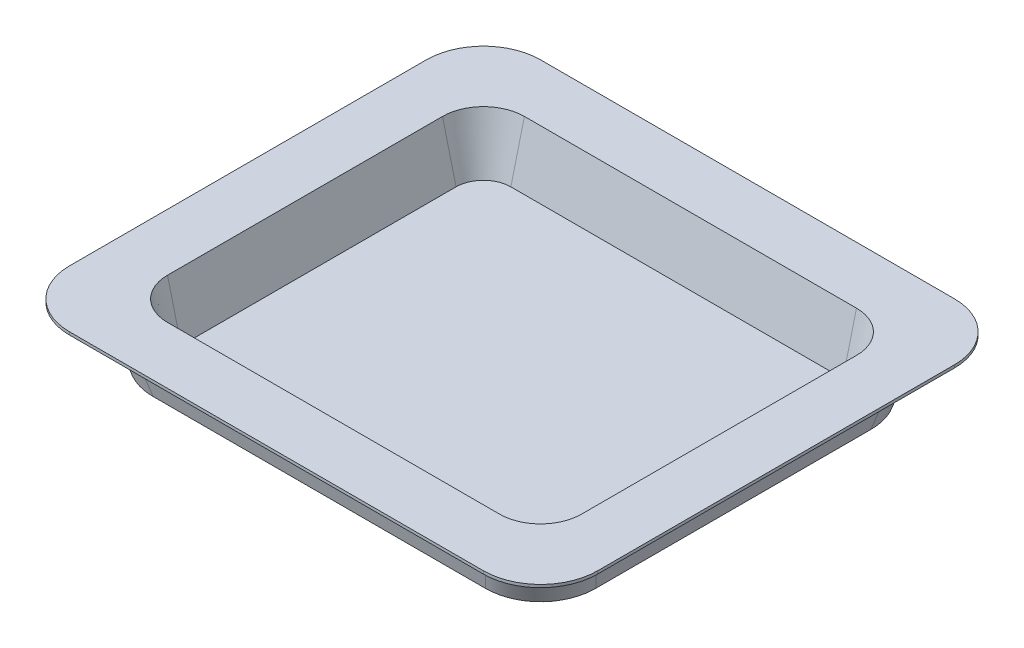
from build123d import *

# Parameters (mm, degrees)
SKETCH8_W                = 469.9
SKETCH8_H                = 419.1
BOSS_EXTRUDE1_DEPTH      = 50.8
CUT_EXTRUDE3_DEPTH       = 48.26
CUT_EXTRUDE4_DEPTH       = 48.26
CUT_EXTRUDE5_DEPTH       = 48.26
CUT_EXTRUDE6_DEPTH       = 48.26
CUT_EXTRUDE7_DEPTH       = 416.052
CUT_EXTRUDE8_DEPTH       = 69.342
CUT_EXTRUDE9_DEPTH       = 104.902
CUT_EXTRUDE9_DEPTH_BACK  = 516.128
CUT_EXTRUDE10_DEPTH      = 483.87
CUT_EXTRUDE10_DEPTH_BACK = 154.432
CUT_EXTRUDE11_DEPTH      = 419.608
CUT_EXTRUDE11_DEPTH_BACK = 113.03
FILLET1_R                = 50.8
FILLET2_R                = 50.8
FILLET3_R                = 50.8
FILLET4_R                = 50.8
CUT_EXTRUDE12_DEPTH      = 113.03
CUT_EXTRUDE13_DEPTH      = 113.03
CUT_EXTRUDE14_DEPTH      = 113.03
CUT_EXTRUDE15_DEPTH      = 113.03
CUT_EXTRUDE18_DEPTH      = 48.26
CUT_EXTRUDE18_TAPER      = 14
BODY_MOVE_COPY1_ANGLE    = 180


with BuildPart() as part:
    # Sketch8 → Boss-Extrude1 (new body)
    with BuildSketch(Plane(origin=(0, 0, 0), x_dir=(1, 0, 0), z_dir=(0, 1, 0))):
        with Locations((163.124113973, 170.845238095)):
            Rectangle(SKETCH8_W, SKETCH8_H)
    extrude(amount=-BOSS_EXTRUDE1_DEPTH)

    # Sketch9 → Cut-Extrude3 (cut)
    with BuildSketch(Plane(origin=(0, 0, 0), x_dir=(1, 0, 0), z_dir=(0, 1, 0))):
        Polygon((-46.425886027, -13.304761905), (372.674113973, -13.304761905), (398.074113973, -38.704761905), (-71.825886027, -38.704761905), align=None)
    extrude(amount=-CUT_EXTRUDE3_DEPTH, mode=Mode.SUBTRACT)

    # Sketch11 → Cut-Extrude4 (cut)
    with BuildSketch(Plane(origin=(0, 0, 0), x_dir=(1, 0, 0), z_dir=(0, 1, 0))):
        Polygon((-46.425886027, 354.995238095), (-46.425886027, -13.304761905), (-71.825886027, -38.704761905), (-71.825886027, 380.395238095), align=None)
    extrude(amount=-CUT_EXTRUDE4_DEPTH, mode=Mode.SUBTRACT)

    # Sketch13 → Cut-Extrude5 (cut)
    with BuildSketch(Plane(origin=(0, 0, 0), x_dir=(1, 0, 0), z_dir=(0, 1, 0))):
        Polygon((-46.425886027, 354.995238095), (372.674113973, 354.995238095), (398.074113973, 380.395238095), (-71.825886027, 380.395238095), align=None)
    extrude(amount=-CUT_EXTRUDE5_DEPTH, mode=Mode.SUBTRACT)

    # Sketch14 → Cut-Extrude6 (cut)
    with BuildSketch(Plane(origin=(0, 0, 0), x_dir=(1, 0, 0), z_dir=(0, 1, 0))):
        Polygon((398.074113973, 380.395238095), (372.674113973, 354.995238095), (372.674113973, -13.304761905), (398.074113973, -38.704761905), align=None)
    extrude(amount=-CUT_EXTRUDE6_DEPTH, mode=Mode.SUBTRACT)

    # Sketch16 → Cut-Extrude7 (cut)
    with BuildSketch(Plane.XY):
        Polygon((-46.425886027, 0), (-33.725886027, 0), (-46.425886027, -48.26), align=None)
    extrude(amount=-CUT_EXTRUDE7_DEPTH, mode=Mode.SUBTRACT)

    # Sketch17 → Cut-Extrude8 (cut)
    with BuildSketch(Plane.XY):
        Polygon((-33.725886027, 0), (-46.425886027, 0), (-46.425886027, -48.26), align=None)
    extrude(amount=CUT_EXTRUDE8_DEPTH, mode=Mode.SUBTRACT)

    # Sketch18 → Cut-Extrude9 (cut, two sides: drawn at the far end of the back side and taken through both)
    with BuildSketch(Plane.XY.offset(-CUT_EXTRUDE9_DEPTH_BACK)):
        Polygon((372.674113973, 0), (359.974113973, 0), (372.674113973, -48.26), align=None)
    extrude(amount=CUT_EXTRUDE9_DEPTH + CUT_EXTRUDE9_DEPTH_BACK, mode=Mode.SUBTRACT)

    # Sketch19 → Cut-Extrude10 (cut, two sides: drawn at the far end of the back side and taken through both)
    with BuildSketch(Plane(origin=(0, 0, 0), x_dir=(0, 0, -1), z_dir=(1, 0, 0)).offset(-CUT_EXTRUDE10_DEPTH_BACK)):
        Polygon((-13.304761905, 0), (-0.604761905, 0), (-13.304761905, -48.26), align=None)
    extrude(amount=CUT_EXTRUDE10_DEPTH + CUT_EXTRUDE10_DEPTH_BACK, mode=Mode.SUBTRACT)

    # Sketch20 → Cut-Extrude11 (cut, two sides: drawn at the far end of the back side and taken through both)
    with BuildSketch(Plane(origin=(0, 0, 0), x_dir=(0, 0, -1), z_dir=(1, 0, 0)).offset(-CUT_EXTRUDE11_DEPTH_BACK)):
        Polygon((354.995238095, 0), (342.295238095, 0), (354.995238095, -48.26), align=None)
    extrude(amount=CUT_EXTRUDE11_DEPTH + CUT_EXTRUDE11_DEPTH_BACK, mode=Mode.SUBTRACT)

    # Fillet1
    fillet1_edges = [part.edges().sort_by_distance(p)[0] for p in [
        (-40.075886027, -24.13, 6.954761905),
    ]]
    fillet(fillet1_edges, radius=FILLET1_R)

    # Fillet2
    fillet2_edges = [part.edges().sort_by_distance(p)[0] for p in [
        (-40.075886027, -24.13, -348.645238095),
    ]]
    fillet(fillet2_edges, radius=FILLET2_R)

    # Fillet3
    fillet3_edges = [part.edges().sort_by_distance(p)[0] for p in [
        (366.324113973, -24.13, -348.645238095),
    ]]
    fillet(fillet3_edges, radius=FILLET3_R)

    # Fillet4
    fillet4_edges = [part.edges().sort_by_distance(p)[0] for p in [
        (366.324113973, -24.13, 6.954761905),
    ]]
    fillet(fillet4_edges, radius=FILLET4_R)

    # Sketch24 → Cut-Extrude12 (cut)
    with BuildSketch(Plane(origin=(0, 0, 0), x_dir=(1, 0, 0), z_dir=(0, 1, 0))):
        with BuildLine():
            Line((-71.825886027, -38.704761905), (-21.025886027, -38.704761905))
            ThreePointArc((-21.025886027, -38.704761905), (-56.946910511, -23.825786389), (-71.825886027, 12.095238095))
            Line((-71.825886027, 12.095238095), (-71.825886027, -38.704761905))
        make_face()
    extrude(amount=-CUT_EXTRUDE12_DEPTH, mode=Mode.SUBTRACT)

    # Sketch25 → Cut-Extrude13 (cut)
    with BuildSketch(Plane(origin=(0, 0, 0), x_dir=(1, 0, 0), z_dir=(0, 1, 0))):
        with BuildLine():
            Line((-71.825886027, 380.395238095), (-21.025886027, 380.395238095))
            ThreePointArc((-21.025886027, 380.395238095), (-56.946910511, 365.51626258), (-71.825886027, 329.595238095))
            Line((-71.825886027, 329.595238095), (-71.825886027, 380.395238095))
        make_face()
    extrude(amount=-CUT_EXTRUDE13_DEPTH, mode=Mode.SUBTRACT)

    # Sketch26 → Cut-Extrude14 (cut)
    with BuildSketch(Plane(origin=(0, 0, 0), x_dir=(1, 0, 0), z_dir=(0, 1, 0))):
        with BuildLine():
            Line((398.074113973, 380.395238095), (347.274113973, 380.395238095))
            ThreePointArc((347.274113973, 380.395238095), (383.195138458, 365.51626258), (398.074113973, 329.595238095))
            Line((398.074113973, 329.595238095), (398.074113973, 380.395238095))
        make_face()
    extrude(amount=-CUT_EXTRUDE14_DEPTH, mode=Mode.SUBTRACT)

    # Sketch27 → Cut-Extrude15 (cut)
    with BuildSketch(Plane(origin=(0, 0, 0), x_dir=(1, 0, 0), z_dir=(0, 1, 0))):
        with BuildLine():
            Line((398.074113973, -38.704761905), (347.274113973, -38.704761905))
            ThreePointArc((347.274113973, -38.704761905), (383.195138458, -23.825786389), (398.074113973, 12.095238095))
            Line((398.074113973, 12.095238095), (398.074113973, -38.704761905))
        make_face()
    extrude(amount=-CUT_EXTRUDE15_DEPTH, mode=Mode.SUBTRACT)

    # Sketch29 → Cut-Extrude18 (cut)
    with BuildSketch(Plane(origin=(0, -50.8, 0), x_dir=(1, 0, 0), z_dir=(0, 1, 0))):
        with BuildLine():
            ThreePointArc((310.846727481, 12.095238095), (336.604779491, 22.764572578), (347.274113973, 48.522624588))
            Line((347.274113973, 48.522624588), (347.274113973, 293.167851602))
            ThreePointArc((347.274113973, 293.167851602), (336.604779491, 318.925903612), (310.846727481, 329.595238095))
            Line((310.846727481, 329.595238095), (15.401500466, 329.595238095))
            ThreePointArc((15.401500466, 329.595238095), (-10.356551544, 318.925903612), (-21.025886027, 293.167851602))
            Line((-21.025886027, 293.167851602), (-21.025886027, 48.522624588))
            ThreePointArc((-21.025886027, 48.522624588), (-10.356551544, 22.764572578), (15.401500466, 12.095238095))
            Line((15.401500466, 12.095238095), (310.846727481, 12.095238095))
        make_face()
    extrude(amount=CUT_EXTRUDE18_DEPTH, taper=CUT_EXTRUDE18_TAPER, mode=Mode.SUBTRACT)


with BuildPart() as part_1:
    # Body-Move/Copy1: moved
    add(part.part.rotate(Axis((163.124113973, -25.4, 0), (0, 0, 1)), BODY_MOVE_COPY1_ANGLE))


solid = part_1.part
